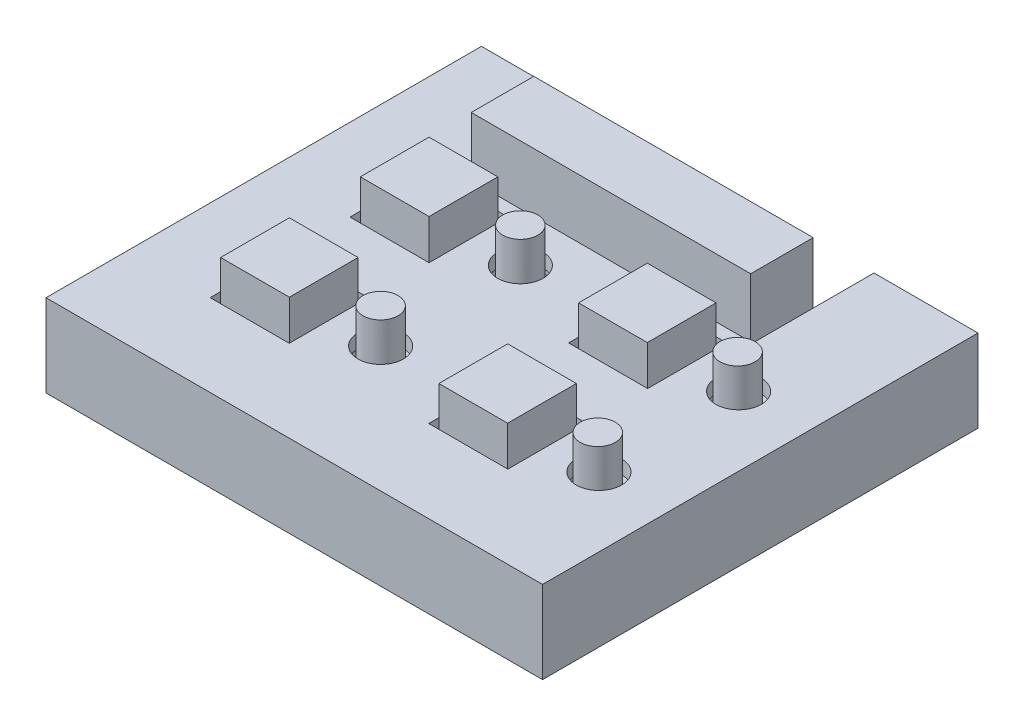
from build123d import *

# Parameters (mm, degrees)
SKETCH1_W             = 62.23
SKETCH1_H             = 53.34
BOSS_EXTRUDE1_DEPTH   = 1.57
SKETCH2_W             = 10
SKETCH2_H             = 10
BOSS_EXTRUDE2_DEPTH   = 12.5
SKETCH3_R             = 2.55
BOSS_EXTRUDE3_DEPTH   = 12.5
SKETCH4_W             = 40.64
SKETCH4_H             = 9.1
BOSS_EXTRUDE4_DEPTH   = 15
SKETCH5_R             = 1.5
CUT_EXTRUDE1_DEPTH    = 44.639799782
SKETCH6_W             = 72.23
SKETCH6_H             = 63.34
BOSS_EXTRUDE5_DEPTH   = 12
SKETCH7_W             = 68.23
SKETCH7_H             = 59.34
CUT_EXTRUDE2_DEPTH    = 10
SKETCH8_R             = 3.3
SKETCH8_W             = 43.19595156
SKETCH8_H             = 17.648733465
SKETCH8_W_2           = 11.5
SKETCH8_H_2           = 11.5
CUT_EXTRUDE3_DEPTH    = 50.510424407
SKETCH9_W             = 8.2149345
SKETCH9_H             = 8.395539661
SKETCH9_R             = 1
BOSS_EXTRUDE6_DEPTH   = 6
SKETCH9_W_2           = 5.685125291
SKETCH9_H_2           = 6.117087564
BOSS_EXTRUDE6_2_DEPTH = 6
BOSS_EXTRUDE6_3_DEPTH = 6
SKETCH9_W_3           = 5.946391127
SKETCH9_H_3           = 8.207214253
BOSS_EXTRUDE6_4_DEPTH = 6


with BuildPart() as part:
    # Sketch1 → Boss-Extrude1 (new body)
    with BuildSketch(Plane(origin=(0, 0, 0), x_dir=(1, 0, 0), z_dir=(0, 1, 0))):
        Rectangle(SKETCH1_W, SKETCH1_H)
    extrude(amount=BOSS_EXTRUDE1_DEPTH)

    # Sketch2 → Boss-Extrude2 (add)
    with BuildSketch(Plane(origin=(0, 1.57, 0), x_dir=(1, 0, 0), z_dir=(0, 1, 0))):
        with Locations((-18.415, -13.97)):
            Rectangle(SKETCH2_W, SKETCH2_H)
        with Locations((13.335, -13.97)):
            Rectangle(SKETCH2_W, SKETCH2_H)
        with Locations((13.335, 6.35)):
            Rectangle(SKETCH2_W, SKETCH2_H)
        with Locations((-18.415, 6.35)):
            Rectangle(SKETCH2_W, SKETCH2_H)
    extrude(amount=BOSS_EXTRUDE2_DEPTH)

    # Sketch3 → Boss-Extrude3 (add)
    with BuildSketch(Plane(origin=(0, 1.57, 0), x_dir=(1, 0, 0), z_dir=(0, 1, 0))):
        with Locations(Location((-5.715, -13.403860223, 0), (0, 0, 90))):
            Circle(SKETCH3_R)
        with Locations(Location((26.034616992, -13.559811685, 0), (0, 0, 90))):
            Circle(SKETCH3_R)
        with Locations(Location((26.04840041, 6.760188315, 0), (0, 0, 90))):
            Circle(SKETCH3_R)
        with Locations(Location((-5.701216582, 6.916139777, 0), (0, 0, 90))):
            Circle(SKETCH3_R)
    extrude(amount=BOSS_EXTRUDE3_DEPTH)

    # Sketch4 → Boss-Extrude4 (add)
    with BuildSketch(Plane(origin=(0, 1.57, 0), x_dir=(1, 0, 0), z_dir=(0, 1, 0))):
        with Locations((-0.635, 19.58)):
            Rectangle(SKETCH4_W, SKETCH4_H)
    extrude(amount=BOSS_EXTRUDE4_DEPTH)

    # Sketch5 → Cut-Extrude1 (cut, through all)
    with BuildSketch(Plane(origin=(0, 1.57, 0), x_dir=(1, 0, 0), z_dir=(0, 1, 0))):
        with Locations(Location((-24.765, 21.59, 0), (0, 0, 270))):
            Circle(SKETCH5_R)
        with Locations(Location((-28.575, -24.13, 0), (0, 0, 270))):
            Circle(SKETCH5_R)
        with Locations(Location((28.575, -24.13, 0), (0, 0, 270))):
            Circle(SKETCH5_R)
        with Locations(Location((28.575, 21.59, 0), (0, 0, 270))):
            Circle(SKETCH5_R)
    extrude(amount=-CUT_EXTRUDE1_DEPTH, mode=Mode.SUBTRACT)


with BuildPart() as body_2:
    # Sketch6 → Boss-Extrude5 (new body)
    with BuildSketch(Plane(origin=(0, 9, 0), x_dir=(1, 0, 0), z_dir=(0, 1, 0))):
        Rectangle(SKETCH6_W, SKETCH6_H)
    extrude(amount=-BOSS_EXTRUDE5_DEPTH)

    # Sketch7 → Cut-Extrude2 (cut)
    with BuildSketch(Plane.XZ.offset(3)):
        Rectangle(SKETCH7_W, SKETCH7_H)
    extrude(amount=-CUT_EXTRUDE2_DEPTH, mode=Mode.SUBTRACT)

    # Sketch8 → Cut-Extrude3 (cut, through all)
    with BuildSketch(Plane(origin=(0, 9, 0), x_dir=(1, 0, 0), z_dir=(0, 1, 0))):
        with Locations(Location((26.048783418, 6.916139777, 0), (0, 0, 270))):
            Circle(SKETCH8_R)
        with Locations(Location((26.048783418, -13.403860223, 0), (0, 0, 270))):
            Circle(SKETCH8_R)
        with Locations(Location((-5.701216582, 6.916139777, 0), (0, 0, 270))):
            Circle(SKETCH8_R)
        with Locations(Location((-5.701216582, -13.403860223, 0), (0, 0, 270))):
            Circle(SKETCH8_R)
        with Locations((-0.609620284, 22.845633268)):
            Rectangle(SKETCH8_W, SKETCH8_H)
        with Locations((13.334966367, 6.396213524)):
            Rectangle(SKETCH8_W_2, SKETCH8_H_2)
        with Locations((-18.415, 6.35)):
            Rectangle(SKETCH8_W_2, SKETCH8_H_2)
        with Locations((13.314875799, -13.923776544)):
            Rectangle(SKETCH8_W_2, SKETCH8_H_2)
        with Locations((-18.435090568, -13.969990068)):
            Rectangle(SKETCH8_W_2, SKETCH8_H_2)
    extrude(amount=-CUT_EXTRUDE3_DEPTH, mode=Mode.SUBTRACT)


with BuildPart() as body_3:
    # Sketch9 → Boss-Extrude6 (new body)
    with BuildSketch(Plane(origin=(0, 1.6, 0), x_dir=(1, 0, 0), z_dir=(0, 1, 0))):
        with Locations((-27.00753275, 22.47223017)):
            Rectangle(SKETCH9_W, SKETCH9_H)
        with Locations(Location((-24.765, 21.59, 0), (0, 0, 270))):
            Circle(SKETCH9_R, mode=Mode.SUBTRACT)
    extrude(amount=BOSS_EXTRUDE6_DEPTH)


with BuildPart() as body_4:
    # Sketch9 → Boss-Extrude6 2 (new body)
    with BuildSketch(Plane(origin=(0, 1.6, 0), x_dir=(1, 0, 0), z_dir=(0, 1, 0))):
        with Locations((-28.272437354, -23.611456218)):
            Rectangle(SKETCH9_W_2, SKETCH9_H_2)
        with Locations(Location((-28.575, -24.13, 0), (0, 0, 270))):
            Circle(SKETCH9_R, mode=Mode.SUBTRACT)
    extrude(amount=BOSS_EXTRUDE6_2_DEPTH)


with BuildPart() as body_5:
    # Sketch9 → Boss-Extrude6 3 (new body)
    with BuildSketch(Plane(origin=(0, 1.6, 0), x_dir=(1, 0, 0), z_dir=(0, 1, 0))):
        with Locations((28.272437354, -23.611456218)):
            Rectangle(SKETCH9_W_2, SKETCH9_H_2)
        with Locations(Location((28.575, -24.13, 0), (0, 0, 270))):
            Circle(SKETCH9_R, mode=Mode.SUBTRACT)
    extrude(amount=BOSS_EXTRUDE6_3_DEPTH)


with BuildPart() as body_6:
    # Sketch9 → Boss-Extrude6 4 (new body)
    with BuildSketch(Plane(origin=(0, 1.6, 0), x_dir=(1, 0, 0), z_dir=(0, 1, 0))):
        with Locations((28.141804437, 22.566392873)):
            Rectangle(SKETCH9_W_3, SKETCH9_H_3)
        with Locations(Location((28.575, 21.59, 0), (0, 0, 270))):
            Circle(SKETCH9_R, mode=Mode.SUBTRACT)
    extrude(amount=BOSS_EXTRUDE6_4_DEPTH)


solid = Compound([part.part, body_2.part, body_3.part, body_4.part, body_5.part, body_6.part])
